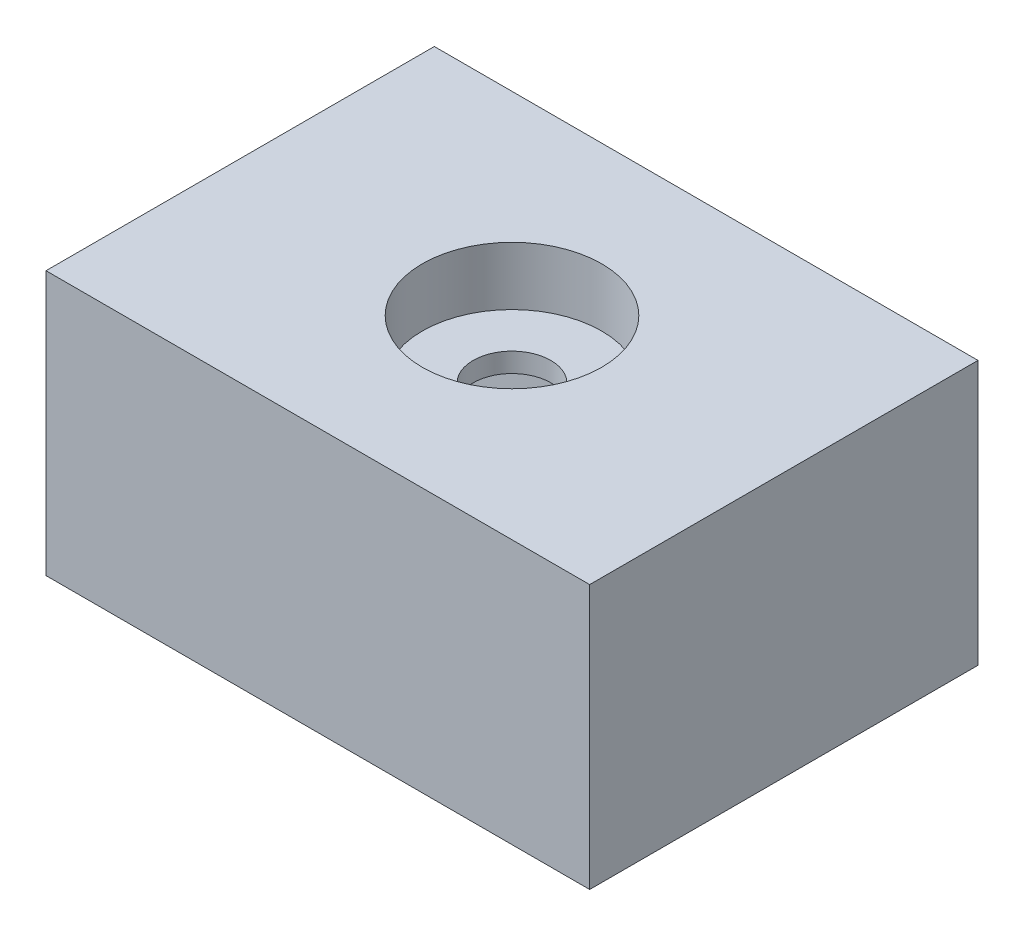
from build123d import *

# Parameters (mm, degrees)
SKETCH1_W           = 177.8
SKETCH1_H           = 127
BOSS_EXTRUDE1_DEPTH = 86.36
SKETCH2_R           = 29.337
CUT_EXTRUDE1_DEPTH  = 19.05
SHELL1_T            = -6.35
SKETCH4_R           = 12.7
CUT_EXTRUDE2_DEPTH  = 6.35


with BuildPart() as part:
    # Sketch1 → Boss-Extrude1 (new body)
    with BuildSketch(Plane(origin=(0, 0, 0), x_dir=(1, 0, 0), z_dir=(0, 1, 0))):
        Rectangle(SKETCH1_W, SKETCH1_H)
    extrude(amount=BOSS_EXTRUDE1_DEPTH)

    # Sketch2 → Cut-Extrude1 (cut)
    with BuildSketch(Plane(origin=(0, 86.36, 0), x_dir=(1, 0, 0), z_dir=(0, 1, 0))):
        with Locations(Location((0, 0, 0), (0, 0, 270))):
            Circle(SKETCH2_R)
    extrude(amount=-CUT_EXTRUDE1_DEPTH, mode=Mode.SUBTRACT)

    # Shell1
    shell1_openings = [part.faces().sort_by_distance(p)[0] for p in [
        (0, 0, 0),
    ]]
    offset(amount=SHELL1_T, openings=shell1_openings, kind=Kind.INTERSECTION)

    # Sketch4 → Cut-Extrude2 (cut)
    with BuildSketch(Plane.XZ.offset(-60.96)):
        with Locations(Location((0, 0, 0), (0, 0, 270))):
            Circle(SKETCH4_R)
    extrude(amount=-CUT_EXTRUDE2_DEPTH, mode=Mode.SUBTRACT)


solid = part.part
